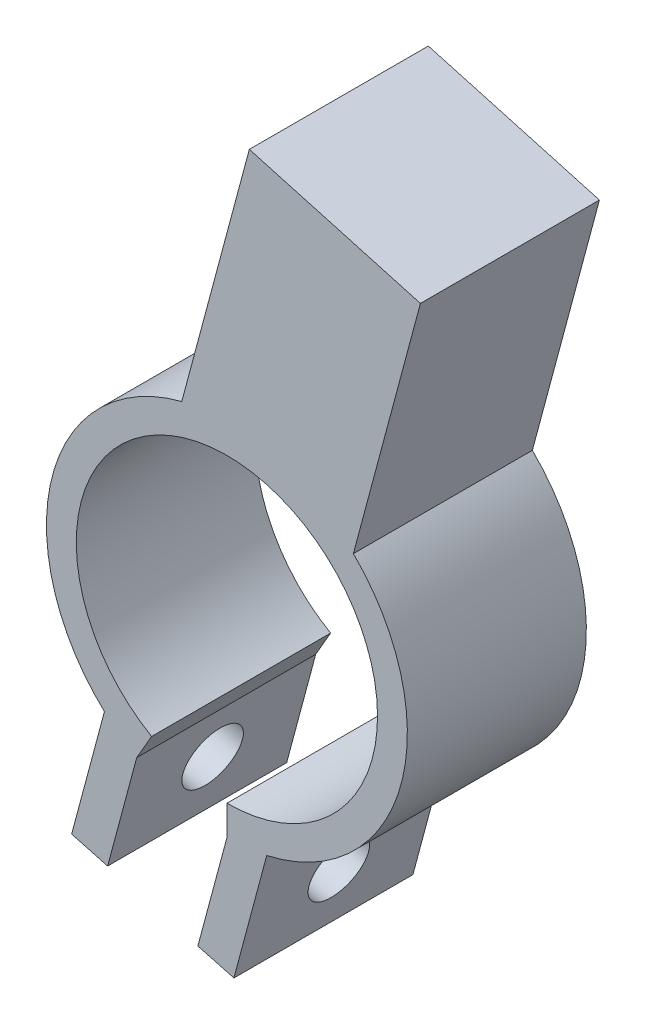
from build123d import *

# Parameters (mm, degrees)
SKETCH1_R           = 24.193
SKETCH1_R_2         = 20.193
BOSS_EXTRUDE1_DEPTH = 24
CUT_EXTRUDE1_DEPTH  = 24
BOSS_EXTRUDE2_START = -24
BOSS_EXTRUDE2_DEPTH = 24
SKETCH4_R           = 4
CUT_EXTRUDE2_DEPTH  = 24
BOSS_EXTRUDE4_START = -24
BOSS_EXTRUDE4_DEPTH = 24


with BuildPart() as part:
    # Sketch1 → Boss-Extrude1 (new body)
    with BuildSketch(Plane.XY):
        Circle(SKETCH1_R)
        Circle(SKETCH1_R_2, mode=Mode.SUBTRACT)
    extrude(amount=BOSS_EXTRUDE1_DEPTH)

    # Sketch2 → Cut-Extrude1 (cut)
    with BuildSketch(Plane.XY.offset(24)):
        Polygon((0, -24.193), (-5.8341998, -24.895299835), (-12.0965, -20.951752594), (0, 0), align=None)
    extrude(amount=-CUT_EXTRUDE1_DEPTH, mode=Mode.SUBTRACT)

    # Sketch3 → Boss-Extrude2 (add)
    with BuildSketch(Plane.XY.offset(24).offset(BOSS_EXTRUDE2_START)):
        with BuildLine():
            Line((-15.990029306, -35.482601784), (-12.0965, -20.951752594))
            ThreePointArc((-12.0965, -20.951752594), (-14.346719144, -19.480064138), (-16.419734671, -17.767767512))
            Line((-16.419734671, -17.767767512), (-20.819658437, -34.188506559))
            Line((-20.819658437, -34.188506559), (-15.990029306, -35.482601784))
        make_face()
        with BuildLine():
            ThreePointArc((5.336023592, -23.597205369), (2.684591171, -24.043589982), (0, -24.193))
            Line((0, -24.193), (-3.893529306, -38.72384919))
            Line((-3.893529306, -38.72384919), (0.936099826, -40.017944416))
            Line((0.936099826, -40.017944416), (5.336023592, -23.597205369))
        make_face()
    extrude(amount=BOSS_EXTRUDE2_DEPTH)

    # Sketch4 → Cut-Extrude2 (cut)
    with BuildSketch(Plane(origin=(-10.877879131, 2.914718929, 0), x_dir=(0, 0, 1), z_dir=(-0.9659258262890682, 0.2588190451025212, 0))):
        with Locations(Location((12, -30.412085563, 0), (0, 0, 270))):
            Circle(SKETCH4_R)
    extrude(amount=-CUT_EXTRUDE2_DEPTH, mode=Mode.SUBTRACT)

    # Sketch5 → Boss-Extrude4 (add)
    with BuildSketch(Plane.XY.offset(24).offset(BOSS_EXTRUDE4_START)):
        with BuildLine():
            ThreePointArc((-6.052435886, 23.423690334), (6.261609158, 23.368643515), (16.953408399, 17.259292937))
            Line((16.953408399, 17.259292937), (25.944897535, 50.81598723))
            Line((25.944897535, 50.81598723), (3.006230693, 57.231094254))
            Line((3.006230693, 57.231094254), (-6.052435886, 23.423690334))
        make_face()
    extrude(amount=BOSS_EXTRUDE4_DEPTH)


solid = part.part
